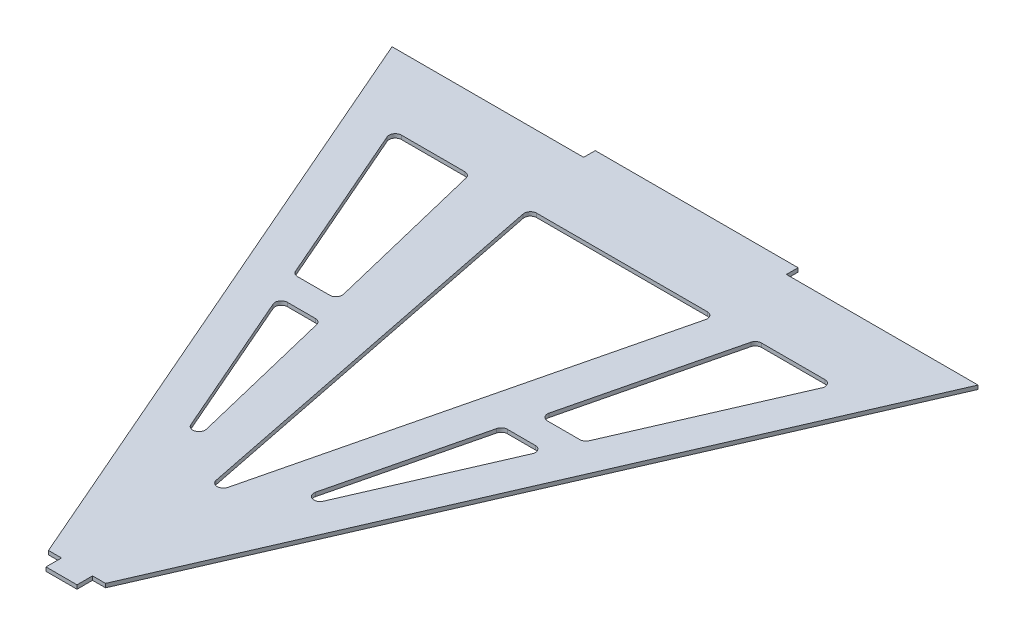
from build123d import *

# Parameters (mm, degrees)
BOSS_EXTRUDE1_DEPTH = 1.5875
CUT_EXTRUDE1_DEPTH  = 288.311537501
CUT_EXTRUDE2_DEPTH  = 1.5875
FILLET1_R           = 2.54


with BuildPart() as part:
    # Sketch2 → Boss-Extrude1 (new body)
    with BuildSketch(Plane(origin=(0, 0, 0), x_dir=(1, 0, 0), z_dir=(0, 1, 0))):
        Polygon((-122.047, 0), (0, 0), (122.047, 0), (11.684, -253.746), (6.35, -253.746), (6.35, -260.096), (-6.35, -260.096), (-6.35, -253.746), (-11.684, -253.746), align=None)
    extrude(amount=BOSS_EXTRUDE1_DEPTH)

    # Sketch3 → Cut-Extrude1 (cut, through all)
    with BuildSketch(Plane(origin=(0, 1.5875, 0), x_dir=(1, 0, 0), z_dir=(0, 1, 0))):
        Polygon((41.529, 0), (41.529, -4.7625), (119.975622372, -4.7625), (122.047, 0), align=None)
        Polygon((-119.975622372, -4.7625), (-122.047, 0), (-41.529, 0), (-41.529, -4.7625), align=None)
    extrude(amount=-CUT_EXTRUDE1_DEPTH, mode=Mode.SUBTRACT)

    # Sketch4 → Cut-Extrude2 (cut)
    with BuildSketch(Plane(origin=(0, 1.5875, 0), x_dir=(1, 0, 0), z_dir=(0, 1, 0))):
        Polygon((37.326544741, -116.821662879), (54.618110353, -116.821662879), (15.355253515, -207.09460645), align=None)
        Polygon((-34.444106562, -34.178727637), (41.755893438, -34.178727637), (0, -205.740215459), align=None)
        Polygon((58.747863162, -34.178727637), (90.562410016, -34.178727637), (59.474716621, -105.655380576), (41.351351035, -105.655380576), align=None)
        Polygon((-15.355253515, -207.09460645), (-37.326544741, -116.821662879), (-54.618110353, -116.821662879), align=None)
        Polygon((-41.351351035, -105.655380576), (-58.747863162, -34.178727637), (-90.562410016, -34.178727637), (-59.474716621, -105.655380576), align=None)
    extrude(amount=-CUT_EXTRUDE2_DEPTH, mode=Mode.SUBTRACT)

    # Fillet1
    fillet1_edges = [part.edges().sort_by_distance(p)[0] for p in [
        (-15.355253515, 0.79375, 207.09460645),
        (-54.618110353, 0.79375, 116.821662879),
        (-37.326544741, 0.79375, 116.821662879),
        (37.326544741, 0.79375, 116.821662879),
        (15.355253515, 0.79375, 207.09460645),
        (54.618110353, 0.79375, 116.821662879),
        (90.562410016, 0.79375, 34.178727637),
        (58.747863162, 0.79375, 34.178727637),
        (41.351351035, 0.79375, 105.655380576),
        (59.474716621, 0.79375, 105.655380576),
        (-41.351351035, 0.79375, 105.655380576),
        (-59.474716621, 0.79375, 105.655380576),
        (-90.562410016, 0.79375, 34.178727637),
        (-58.747863162, 0.79375, 34.178727637),
        (-34.444106562, 0.79375, 34.178727637),
        (0, 0.79375, 205.740215459),
        (41.755893438, 0.79375, 34.178727637),
    ]]
    fillet(fillet1_edges, radius=FILLET1_R)


solid = part.part
